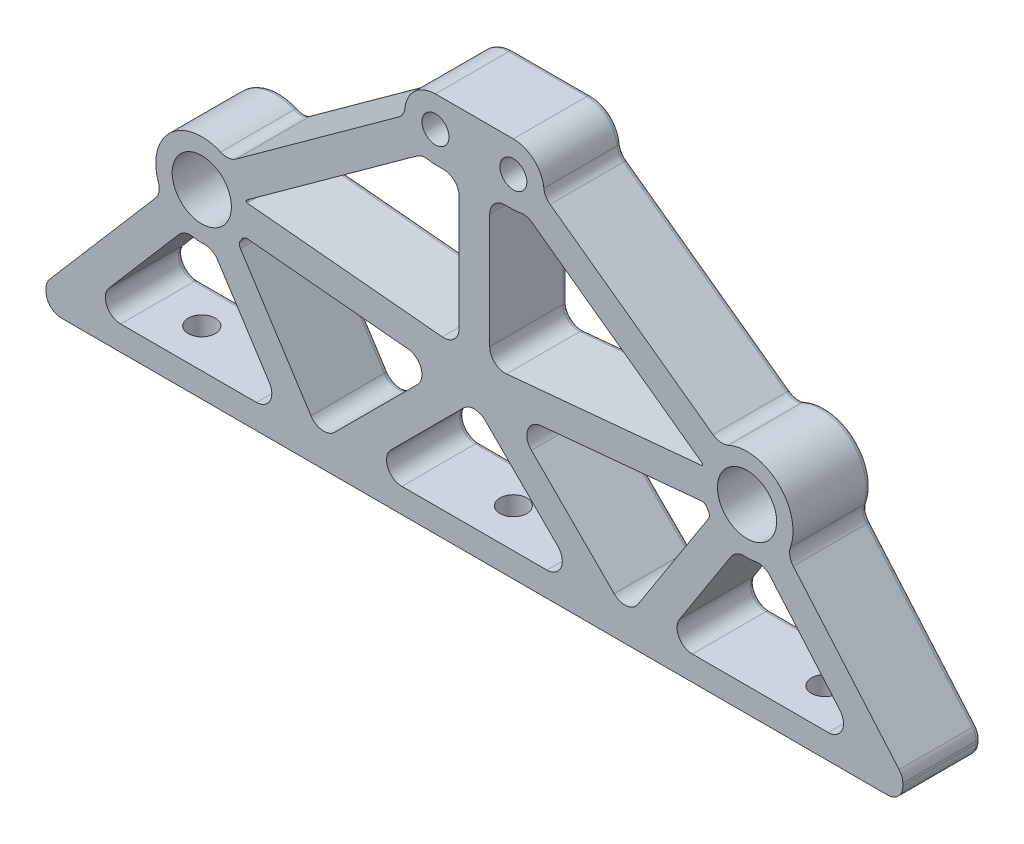
from build123d import *

# Parameters (mm, degrees)
SKETCH3_R           = 4.826
BOSS_EXTRUDE1_DEPTH = 12.7
SKETCH5_R           = 2.2
BOSS_EXTRUDE3_DEPTH = 12.7
FILLET1_R           = 2.5
FILLET5_R           = 0.2
FILLET6_R           = 1
CUT_EXTRUDE1_REACH  = 172.955
SKETCH4_R           = 2.2
SKETCH3_3_R         = 4.826
SKETCH3_3_R_2       = 2.5
BOSS_EXTRUDE2_DEPTH = 3.175
FILLET2_R           = 0.75


with BuildPart() as part:
    # Sketch3 → Boss-Extrude1 (new body)
    with BuildSketch(Plane.XY):
        with BuildLine():
            Line((19.05, 10.186822594), (19.05, 6.35))
            Line((19.05, 6.35), (158.75, 6.35))
            Line((158.75, 6.35), (158.75, 10.186822594))
            Line((158.75, 10.186822594), (139.853820201, 32.186011393))
            ThreePointArc((139.853820201, 32.186011393), (136.158237244, 42.875433415), (126.076294616, 37.749469175))
            Line((126.076294616, 37.749469175), (88.9, 34.260982446))
            Line((88.9, 34.260982446), (51.723705384, 37.749469175))
            ThreePointArc((51.723705384, 37.749469175), (41.641762756, 42.875433415), (37.946179799, 32.186011393))
            Line((37.946179799, 32.186011393), (19.05, 10.186822594))
        make_face()
        with BuildLine():
            Line((25.781430424, 10.35), (41.739075919, 28.928107309))
            ThreePointArc((41.739075919, 28.928107309), (43.93526316, 28.438708935), (46.177778996, 28.622752104))
            Line((46.177778996, 28.622752104), (57.949299721, 10.35))
            Line((57.949299721, 10.35), (25.781430424, 10.35))
        make_face(mode=Mode.SUBTRACT)
        with BuildLine():
            Line((63.923437662, 10.308971568), (50.381079567, 31.330567517))
            ThreePointArc((50.381079567, 31.330567517), (50.859440021, 32.026274349), (51.256575867, 32.771337998))
            Line((51.256575867, 32.771337998), (83.372192746, 29.757726652))
            Line((83.372192746, 29.757726652), (63.923437662, 10.308971568))
        make_face(mode=Mode.SUBTRACT)
        with BuildLine():
            Line((94.427807254, 29.757726652), (126.543424133, 32.771337998))
            ThreePointArc((126.543424133, 32.771337998), (126.940559979, 32.026274349), (127.418920433, 31.330567517))
            Line((127.418920433, 31.330567517), (113.876562338, 10.308971568))
            Line((113.876562338, 10.308971568), (94.427807254, 29.757726652))
        make_face(mode=Mode.SUBTRACT)
        with BuildLine():
            Line((119.850700279, 10.35), (131.622221004, 28.622752104))
            ThreePointArc((131.622221004, 28.622752104), (133.86473684, 28.438708935), (136.060924081, 28.928107309))
            Line((136.060924081, 28.928107309), (152.018569576, 10.35))
            Line((152.018569576, 10.35), (119.850700279, 10.35))
        make_face(mode=Mode.SUBTRACT)
        Polygon((88.9, 28.214466094), (106.764466094, 10.35), (71.035533906, 10.35), align=None, mode=Mode.SUBTRACT)
        with Locations((44.45, 35.921024484)):
            Circle(SKETCH3_R, mode=Mode.SUBTRACT)
        with Locations((133.35, 35.921024484)):
            Circle(SKETCH3_R, mode=Mode.SUBTRACT)
    extrude(amount=BOSS_EXTRUDE1_DEPTH)

    # Sketch5 → Boss-Extrude3 (add)
    with BuildSketch(Plane(origin=(0, 0, 0), x_dir=(-1, 0, 0), z_dir=(0, 0, -1))):
        with BuildLine():
            Line((-82.55, 68.5), (-95.25, 68.5))
            ThreePointArc((-95.25, 68.5), (-98.962779291, 66.848920713), (-100.223521387, 62.986107976))
            Line((-100.223521387, 62.986107976), (-129.087983844, 42.092346732))
            ThreePointArc((-129.087983844, 42.092346732), (-127.274625217, 40.318730846), (-126.156179603, 38.042096877))
            Line((-126.156179603, 38.042096877), (-97.291717146, 58.93585812))
            ThreePointArc((-97.291717146, 58.93585812), (-96.293860767, 58.610178459), (-95.25, 58.5))
            Line((-95.25, 58.5), (-91.4, 58.5))
            Line((-91.4, 58.5), (-91.4, 34.49557325))
            Line((-91.4, 34.49557325), (-88.9, 34.260982446))
            Line((-88.9, 34.260982446), (-86.4, 34.49557325))
            Line((-86.4, 34.49557325), (-86.4, 58.5))
            Line((-86.4, 58.5), (-82.55, 58.5))
            ThreePointArc((-82.55, 58.5), (-81.506139233, 58.610178459), (-80.508282854, 58.93585812))
            Line((-80.508282854, 58.93585812), (-51.643820397, 38.042096877))
            ThreePointArc((-51.643820397, 38.042096877), (-50.525374783, 40.318730846), (-48.712016156, 42.092346732))
            Line((-48.712016156, 42.092346732), (-77.576478613, 62.986107976))
            ThreePointArc((-77.576478613, 62.986107976), (-78.837220709, 66.848920713), (-82.55, 68.5))
        make_face()
        with Locations((-95.25, 63.5)):
            Circle(SKETCH5_R, mode=Mode.SUBTRACT)
        with Locations((-82.55, 63.5)):
            Circle(SKETCH5_R, mode=Mode.SUBTRACT)
    extrude(amount=-BOSS_EXTRUDE3_DEPTH)

    # Fillet1
    fillet1_edges = [part.edges().sort_by_distance(p)[0] for p in [
        (158.75, 6.35, 6.35),
        (158.75, 10.186822594, 6.35),
        (19.05, 6.35, 6.35),
        (19.05, 10.186822594, 6.35),
        (139.853820201, 32.186011393, 6.35),
        (152.018569576, 10.35, 6.35),
        (136.060924081, 28.928107309, 6.35),
        (131.622221004, 28.622752104, 6.35),
        (119.850700279, 10.35, 6.35),
        (113.876562338, 10.308971568, 6.35),
        (106.764466094, 10.35, 6.35),
        (25.781430424, 10.35, 6.35),
        (41.739075919, 28.928107309, 6.35),
        (46.177778996, 28.622752104, 6.35),
        (57.949299721, 10.35, 6.35),
        (71.035533906, 10.35, 6.35),
        (63.923437662, 10.308971568, 6.35),
        (37.946179799, 32.186011393, 6.35),
        (88.9, 28.214466094, 6.35),
        (94.427807254, 29.757726652, 6.35),
        (83.372192746, 29.757726652, 6.35),
        (91.4, 34.49557325, 6.35),
        (86.4, 34.49557325, 6.35),
        (129.087983844, 42.092346732, 6.35),
        (48.712016156, 42.092346732, 6.35),
        (100.223521387, 62.986107976, 6.35),
        (77.576478613, 62.986107976, 6.35),
        (80.508282854, 58.93585812, 6.35),
        (86.4, 58.5, 6.35),
        (91.4, 58.5, 6.35),
        (97.291717146, 58.93585812, 6.35),
    ]]
    fillet(fillet1_edges, radius=FILLET1_R)

    # Fillet5
    fillet5_edges = [part.edges().sort_by_distance(p)[0] for p in [
        (126.076294616, 37.749469175, 6.35),
        (126.156179603, 38.042096877, 6.35),
        (51.723705384, 37.749469175, 6.35),
        (51.643820397, 38.042096877, 6.35),
    ]]
    fillet(fillet5_edges, radius=FILLET5_R)

    # Fillet6
    fillet6_edges = [part.edges().sort_by_distance(p)[0] for p in [
        (50.381079567, 31.330567517, 6.35),
        (51.256575867, 32.771337998, 6.35),
        (126.543424133, 32.771337998, 6.35),
        (127.418920433, 31.330567517, 6.35),
    ]]
    fillet(fillet6_edges, radius=FILLET6_R)

    # Sketch4 → Cut-Extrude1 (cut, up to next)
    with BuildSketch(Plane.XZ.offset(-6.35), mode=Mode.PRIVATE) as cut_extrude1_sk1:
        with Locations((38.1, 6.35)):
            Circle(SKETCH4_R)
    cut_extrude1_tool1 = extrude(cut_extrude1_sk1.sketch, amount=-CUT_EXTRUDE1_REACH, mode=Mode.PRIVATE) & part.part
    # Sketch4 → Cut-Extrude1 (cut, up to next)
    with BuildSketch(Plane.XZ.offset(-6.35), mode=Mode.PRIVATE) as cut_extrude1_sk2:
        with Locations((88.9, 6.35)):
            Circle(SKETCH4_R)
    cut_extrude1_tool2 = extrude(cut_extrude1_sk2.sketch, amount=-CUT_EXTRUDE1_REACH, mode=Mode.PRIVATE) & part.part
    # Sketch4 → Cut-Extrude1 (cut, up to next)
    with BuildSketch(Plane.XZ.offset(-6.35), mode=Mode.PRIVATE) as cut_extrude1_sk3:
        with Locations((139.7, 6.35)):
            Circle(SKETCH4_R)
    cut_extrude1_tool3 = extrude(cut_extrude1_sk3.sketch, amount=-CUT_EXTRUDE1_REACH, mode=Mode.PRIVATE) & part.part
    add(cut_extrude1_tool1.solids().sort_by_distance((38.1, 6.35, 6.35))[0], mode=Mode.SUBTRACT)
    add(cut_extrude1_tool2.solids().sort_by_distance((88.9, 6.35, 6.35))[0], mode=Mode.SUBTRACT)
    add(cut_extrude1_tool3.solids().sort_by_distance((139.7, 6.35, 6.35))[0], mode=Mode.SUBTRACT)

    # Sketch3<3> → Boss-Extrude2 (add)
    # profile 1 of 2: a face of its own
    with BuildSketch(Plane.XY):
        with Locations((44.45, 35.921024484)):
            Circle(SKETCH3_3_R)
        with Locations((44.45, 35.921024484)):
            Circle(SKETCH3_3_R_2, mode=Mode.SUBTRACT)
    # profile 2 of 2: a face of its own
    with BuildSketch(Plane.XY):
        with Locations((133.35, 35.921024484)):
            Circle(SKETCH3_3_R)
        with Locations((133.35, 35.921024484)):
            Circle(SKETCH3_3_R_2, mode=Mode.SUBTRACT)
    extrude(amount=BOSS_EXTRUDE2_DEPTH)

    # Fillet2
    fillet2_edges = [part.edges().sort_by_distance(p)[0] for p in [
        (130.85, 35.921024484, 0),
        (41.95, 35.921024484, 0),
        (74.761368981, 11.893291419, 0),
        (81.217766953, 20.532233047, 0),
        (88.9, 27.178932188, 0),
        (96.582233047, 20.532233047, 0),
        (103.038631019, 11.893291419, 0),
        (88.9, 10.35, 0),
        (136.027855456, 28.452569492, 0),
        (142.784208978, 21.100767848, 0),
        (148.847387824, 11.806539437, 0),
        (135.50532278, 10.35, 0),
        (122.24022888, 11.653080885, 0),
        (126.547504566, 20.745347168, 0),
        (131.720098014, 28.156222534, 0),
        (133.86473684, 28.438708935, 0),
        (46.079901986, 28.156222534, 0),
        (51.252495434, 20.745347168, 0),
        (55.55977112, 11.653080885, 0),
        (42.29467722, 10.35, 0),
        (28.952612176, 11.806539437, 0),
        (35.015791022, 21.100767848, 0),
        (41.772144544, 28.452569492, 0),
        (43.93526316, 28.438708935, 0),
        (65.003236574, 31.481401926, 0),
        (80.196297049, 28.613104189, 0),
        (72.863397361, 19.248931267, 0),
        (64.081000563, 11.782121218, 0),
        (56.495902462, 21.838621188, 0),
        (158.594261094, 10.129118919, 0),
        (149.51787576, 20.934986843, 0),
        (140.328903302, 32.146949961, 0),
        (138.428414251, 41.440055984, 0),
        (110.035218557, 36.244233607, 0),
        (67.764781443, 36.244233607, 0),
        (39.371585749, 41.440055984, 0),
        (37.471096698, 32.146949961, 0),
        (28.28212424, 20.934986843, 0),
        (19.205738906, 10.129118919, 0),
        (19.05, 9.055266953, 0),
        (19.782233047, 7.082233047, 0),
        (88.9, 6.35, 0),
        (158.017766953, 7.082233047, 0),
        (158.75, 9.055266953, 0),
        (121.304097538, 21.838621188, 0),
        (113.718999437, 11.782121218, 0),
        (104.936602639, 19.248931267, 0),
        (97.603702951, 28.613104189, 0),
        (112.796763426, 31.481401926, 0),
        (86.4, 46.62057325, 0),
        (65.622420326, 48.160613024, 0),
        (114.522441355, 52.635725727, 0),
        (63.277558645, 52.635725727, 0),
        (112.177579674, 48.160613024, 0),
        (91.4, 46.62057325, 0),
        (85.583164891, 35.392645499, 0),
        (129.009619696, 42.56254755, 0),
        (48.790380304, 42.56254755, 0),
        (92.216835109, 35.392645499, 0),
        (97.45, 63.5, 0),
        (84.75, 63.5, 0),
        (83.225, 58.5, 0),
        (88.9, 68.5, 0),
        (79.201466258, 67.2131283, 0),
        (95.785246601, 58.528731442, 0),
        (80.442061599, 58.619023064, 0),
        (82.014753399, 58.528731442, 0),
        (85.667766953, 57.767766953, 0),
        (100.545188022, 63.022167426, 0),
        (98.598533742, 67.2131283, 0),
        (77.254811978, 63.022167426, 0),
        (92.132233047, 57.767766953, 0),
        (94.575, 58.5, 0),
        (97.357938401, 58.619023064, 0),
        (50.587240411, 31.305677989, 0),
        (50.859440021, 32.026274349, 0),
        (51.373636317, 32.599819388, 0),
        (51.685841853, 38.028512551, 0),
        (51.752995551, 37.782520994, 0),
        (51.685242449, 37.896186933, 0),
        (127.212759589, 31.305677989, 0),
        (126.426363683, 32.599819388, 0),
        (126.940559979, 32.026274349, 0),
        (126.114158147, 38.028512551, 0),
        (126.114757551, 37.896186933, 0),
        (126.047004449, 37.782520994, 0),
    ]]
    fillet(fillet2_edges, radius=FILLET2_R)


solid = part.part
